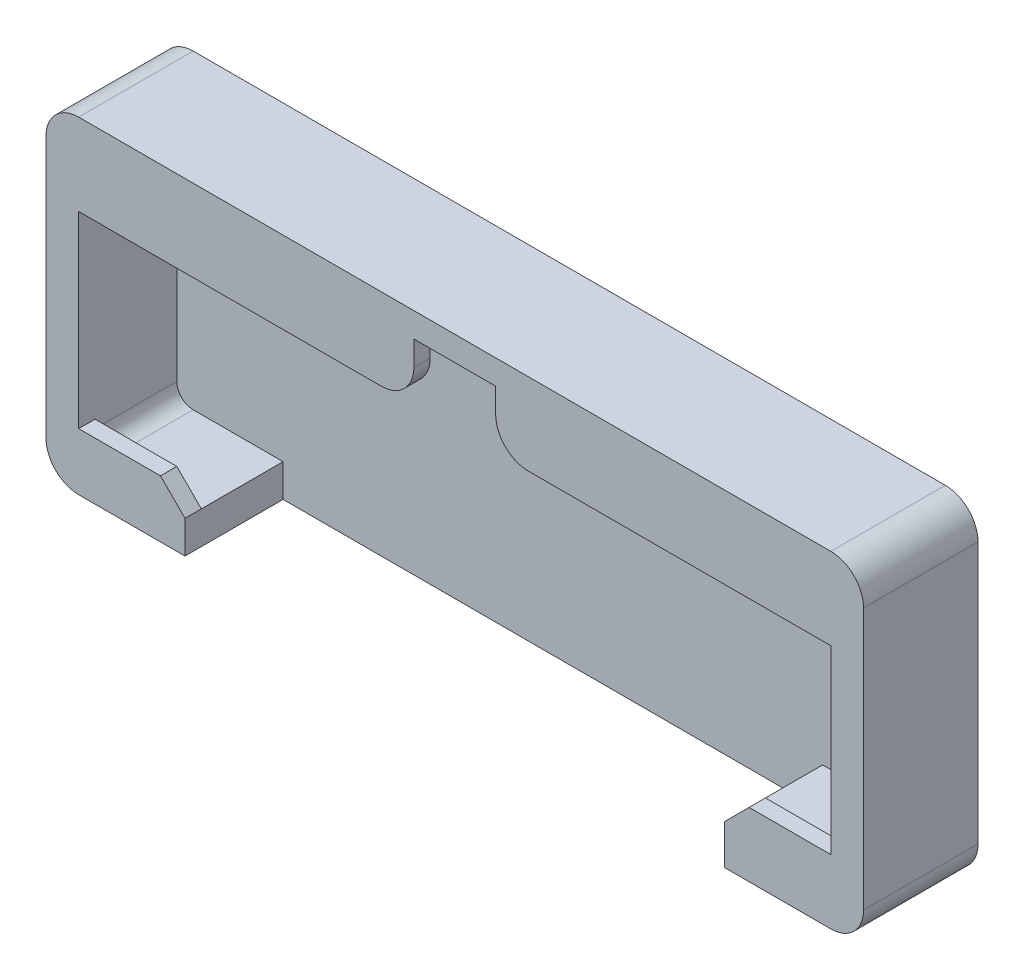
from build123d import *

# Parameters (mm, degrees)
SKETCH1_W           = 50
SKETCH1_H           = 20
BOSS_EXTRUDE1_DEPTH = 1
BOSS_EXTRUDE2_DEPTH = 6
SKETCH3_W           = 46
SKETCH3_H           = 1
BOSS_EXTRUDE3_DEPTH = 4
SKETCH4_W           = 6.5
SKETCH4_H           = 2
SKETCH4_H_2         = 2.438820915
BOSS_EXTRUDE4_DEPTH = 6
SKETCH5_W           = 6.5
SKETCH5_H           = 1
BOSS_EXTRUDE5_DEPTH = 1.5
SKETCH6_W           = 6.5
SKETCH6_H           = 1
BOSS_EXTRUDE6_DEPTH = 1.5
CHAMFER1_SIZE       = 1.5
FILLET1_R           = 2
FILLET2_R           = 1
SKETCH7_W           = 5
SKETCH7_H           = 3.5
CUT_EXTRUDE1_DEPTH  = 2
FILLET3_R           = 2


with BuildPart() as part:
    # Sketch1 → Boss-Extrude1 (new body)
    with BuildSketch(Plane.XY):
        Rectangle(SKETCH1_W, SKETCH1_H)
    extrude(amount=BOSS_EXTRUDE1_DEPTH)

    # Sketch2 → Boss-Extrude2 (add)
    with BuildSketch(Plane.XY.offset(1)):
        Polygon((-25, 10), (25, 10), (25, 9), (25, -10), (23, -10), (23, 9), (-23, 9), (-23, -10), (-25, -10), (-25, 9), align=None)
    extrude(amount=BOSS_EXTRUDE2_DEPTH)

    # Sketch3 → Boss-Extrude3 (add)
    with BuildSketch(Plane.XZ.offset(-9)):
        with Locations((0, 6.5)):
            Rectangle(SKETCH3_W, SKETCH3_H)
    extrude(amount=BOSS_EXTRUDE3_DEPTH)

    # Sketch4 → Boss-Extrude4 (add)
    with BuildSketch(Plane.XY.offset(1)):
        with Locations((-19.75, -9)):
            Rectangle(SKETCH4_W, SKETCH4_H)
        with Locations((19.75, -8.780589542)):
            Rectangle(SKETCH4_W, SKETCH4_H_2)
    extrude(amount=BOSS_EXTRUDE4_DEPTH)

    # Sketch5 → Boss-Extrude5 (add)
    with BuildSketch(Plane(origin=(0, -8, 0), x_dir=(1, 0, 0), z_dir=(0, 1, 0))):
        with Locations((-19.75, -6.5)):
            Rectangle(SKETCH5_W, SKETCH5_H)
    extrude(amount=BOSS_EXTRUDE5_DEPTH)

    # Sketch6 → Boss-Extrude6 (add)
    with BuildSketch(Plane(origin=(0, -7.561179085, 0), x_dir=(1, 0, 0), z_dir=(0, 1, 0))):
        with Locations((19.75, -6.5)):
            Rectangle(SKETCH6_W, SKETCH6_H)
    extrude(amount=BOSS_EXTRUDE6_DEPTH)

    # Chamfer1
    chamfer1_edges = [part.edges().sort_by_distance(p)[0] for p in [
        (16.5, -6.061179085, 6.5),
        (-16.5, -6.5, 6.5),
    ]]
    chamfer(chamfer1_edges, length=CHAMFER1_SIZE)

    # Fillet1
    fillet1_edges = [part.edges().sort_by_distance(p)[0] for p in [
        (25, -10, 3.5),
        (-25, -10, 3.5),
        (-25, 10, 3.5),
        (25, 10, 3.5),
    ]]
    fillet(fillet1_edges, radius=FILLET1_R)

    # Fillet2
    fillet2_edges = [part.edges().sort_by_distance(p)[0] for p in [
        (23, 9, 3.5),
        (-23, 9, 3.5),
        (-23, -8, 3.5),
        (23, -7.561179085, 3.5),
    ]]
    fillet(fillet2_edges, radius=FILLET2_R)

    # Sketch7 → Cut-Extrude1 (cut)
    with BuildSketch(Plane.XY.offset(7)):
        with Locations((0, 6.75)):
            Rectangle(SKETCH7_W, SKETCH7_H)
    extrude(amount=-CUT_EXTRUDE1_DEPTH, mode=Mode.SUBTRACT)

    # Fillet3
    fillet3_edges = [part.edges().sort_by_distance(p)[0] for p in [
        (-2.5, 5, 6.5),
        (2.5, 5, 6.5),
    ]]
    fillet(fillet3_edges, radius=FILLET3_R)


solid = part.part
